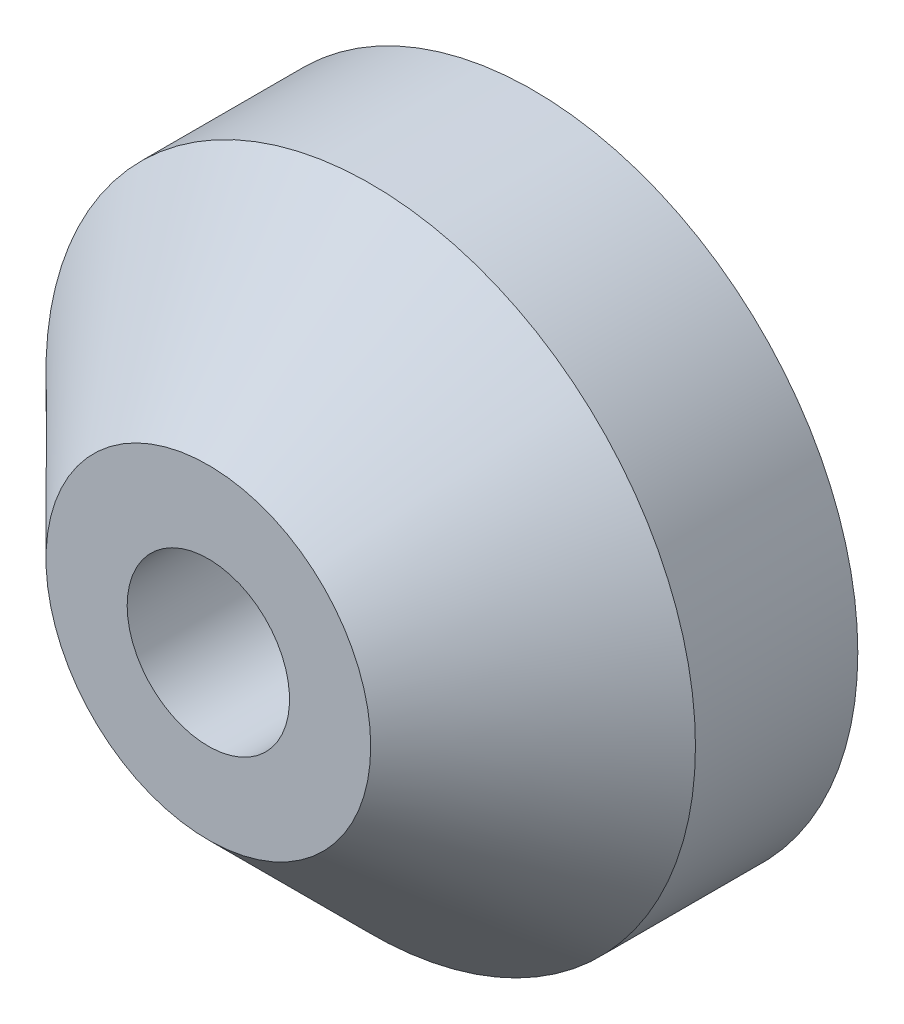
from build123d import *

# Parameters (mm, degrees)
SKETCH1_R           = 5
BOSS_EXTRUDE1_DEPTH = 5
CHAMFER1_SIZE       = 2.5
SKETCH2_R           = 1.25
CUT_EXTRUDE1_DEPTH  = 5
SKETCH3_R           = 2.5
CUT_EXTRUDE2_DEPTH  = 2.5


with BuildPart() as part:
    # Sketch1 → Boss-Extrude1 (new body)
    with BuildSketch(Plane.XY):
        Circle(SKETCH1_R)
    extrude(amount=BOSS_EXTRUDE1_DEPTH)

    # Chamfer1
    chamfer1_edges = [part.edges().sort_by_distance(p)[0] for p in [
        (-5, 0, 5),
    ]]
    chamfer(chamfer1_edges, length=CHAMFER1_SIZE)

    # Sketch2 → Cut-Extrude1 (cut)
    with BuildSketch(Plane(origin=(0, 0, 0), x_dir=(-1, 0, 0), z_dir=(0, 0, -1))):
        Circle(SKETCH2_R)
    extrude(amount=-CUT_EXTRUDE1_DEPTH, mode=Mode.SUBTRACT)

    # Sketch3 → Cut-Extrude2 (cut)
    with BuildSketch(Plane(origin=(0, 0, 0), x_dir=(-1, 0, 0), z_dir=(0, 0, -1))):
        Circle(SKETCH3_R)
    extrude(amount=-CUT_EXTRUDE2_DEPTH, mode=Mode.SUBTRACT)


solid = part.part
